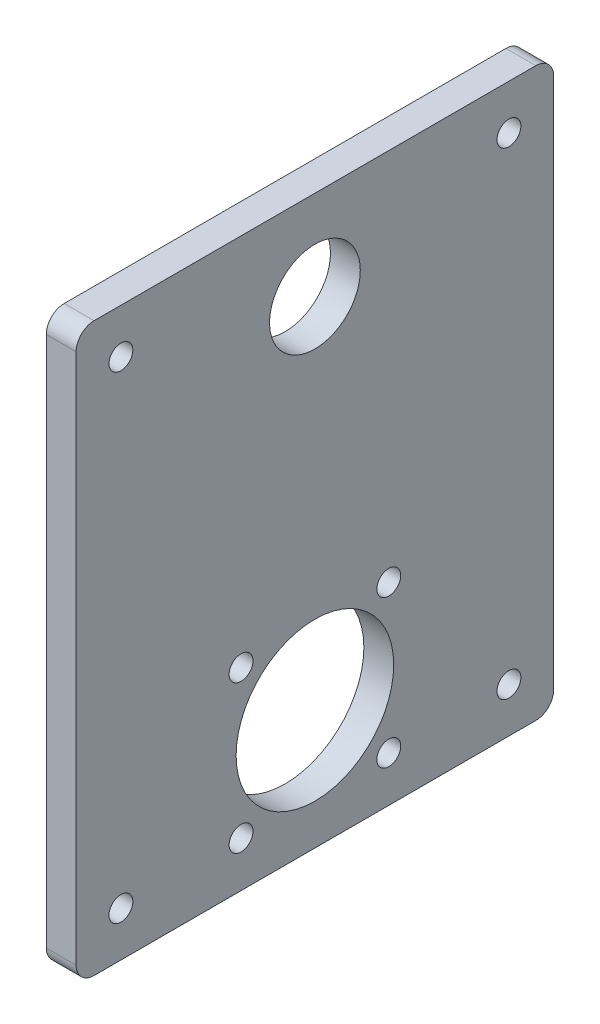
from build123d import *

# Parameters (mm, degrees)
SKETCH_1_W      = 80
SKETCH_1_H      = 95
SKETCH_1_R      = 7.6
SKETCH_1_R_2    = 2
SKETCH_1_R_3    = 13.2
EXTRUDE_1_DEPTH = 5
FILLET_1_R      = 3


with BuildPart() as part:
    # ｽｹｯﾁ1 → ﾎﾞｽ - 押し出し1 (new body)
    with BuildSketch(Plane(origin=(0, 0, 0), x_dir=(0, 0, -1), z_dir=(1, 0, 0))):
        Rectangle(SKETCH_1_W, SKETCH_1_H)
        with Locations((0, 32.5)):
            Circle(SKETCH_1_R, mode=Mode.SUBTRACT)
        with Locations((12.374368671, -15.125631329)):
            Circle(SKETCH_1_R_2, mode=Mode.SUBTRACT)
        with Locations(Location((12.374368671, -39.874368671, 0), (0, 0, 180))):
            Circle(SKETCH_1_R_2, mode=Mode.SUBTRACT)
        with Locations((-12.374368671, -39.874368671)):
            Circle(SKETCH_1_R_2, mode=Mode.SUBTRACT)
        with Locations(Location((-12.374368671, -15.125631329, 0), (0, 0, 180))):
            Circle(SKETCH_1_R_2, mode=Mode.SUBTRACT)
        with Locations((0, -27.5)):
            Circle(SKETCH_1_R_3, mode=Mode.SUBTRACT)
        with Locations((32.5, 40)):
            Circle(SKETCH_1_R_2, mode=Mode.SUBTRACT)
        with Locations(Location((32.5, -40, 0), (0, 0, 180))):
            Circle(SKETCH_1_R_2, mode=Mode.SUBTRACT)
        with Locations((-32.5, -40)):
            Circle(SKETCH_1_R_2, mode=Mode.SUBTRACT)
        with Locations(Location((-32.5, 40, 0), (0, 0, 180))):
            Circle(SKETCH_1_R_2, mode=Mode.SUBTRACT)
    extrude(amount=EXTRUDE_1_DEPTH)

    # ﾌｨﾚｯﾄ1
    fillet_1_edges = [part.edges().sort_by_distance(p)[0] for p in [
        (2.5, -47.5, -40),
        (2.5, -47.5, 40),
        (2.5, 47.5, 40),
        (2.5, 47.5, -40),
    ]]
    fillet(fillet_1_edges, radius=FILLET_1_R)


solid = part.part
